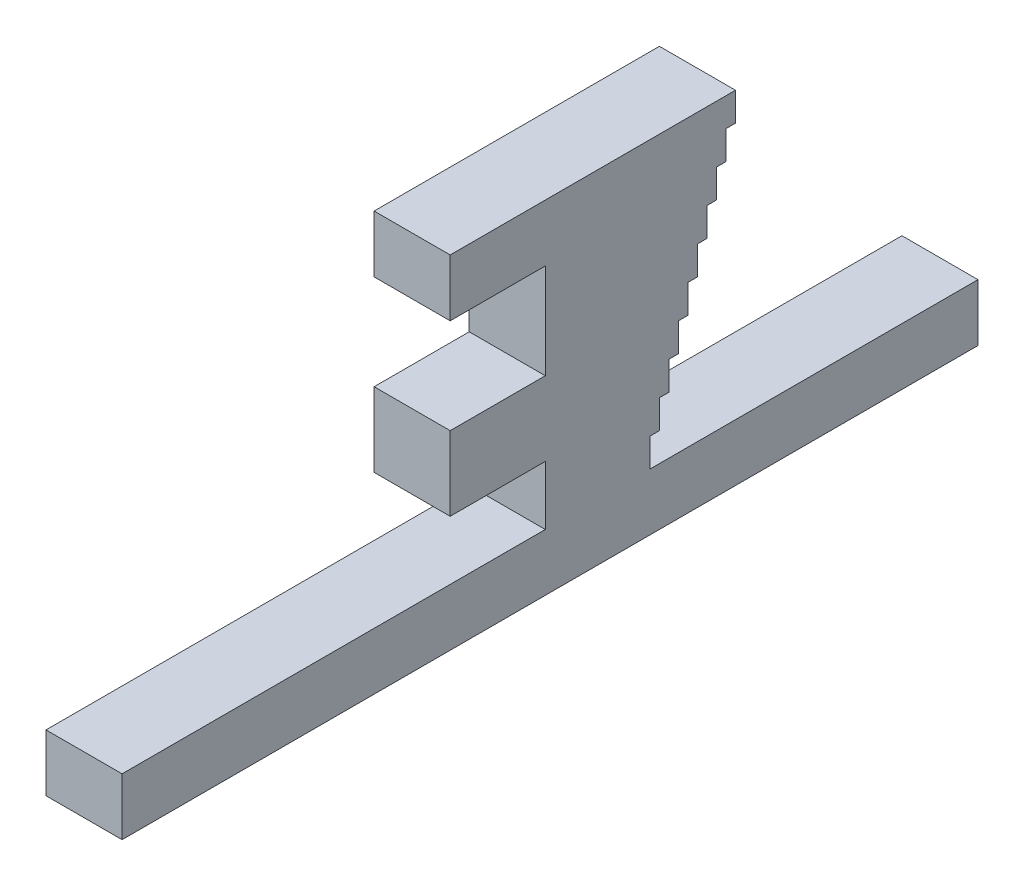
from build123d import *

# Parameters (mm, degrees)
BOSS_EXTRUDE1_DEPTH = 4


with BuildPart() as part:
    # Sketch1 → Boss-Extrude1 (new body)
    with BuildSketch(Plane(origin=(0, 0, 0), x_dir=(0, 0, -1), z_dir=(1, 0, 0))):
        Polygon((-4, 0), (13.25, 0), (13.25, -3), (-31.75, -3), (-31.75, 0), (-14.5, 0), (-9.5, 0), (-9.5, 3.1), (-14.5, 3.1), (-14.5, 7), (-9.5, 7), (-9.5, 12), (-14.5, 12), (-14.5, 15), (0.5, 15), (0.5, 13.5), (0, 13.5), (0, 12), (-0.5, 12), (-0.5, 10.5), (-1, 10.5), (-1, 9), (-1.5, 9), (-1.5, 7.5), (-2, 7.5), (-2, 6), (-2.5, 6), (-2.5, 4.5), (-3, 4.5), (-3, 3), (-3.5, 3), (-3.5, 1.5), (-4, 1.5), align=None)
    extrude(amount=BOSS_EXTRUDE1_DEPTH)


solid = part.part
